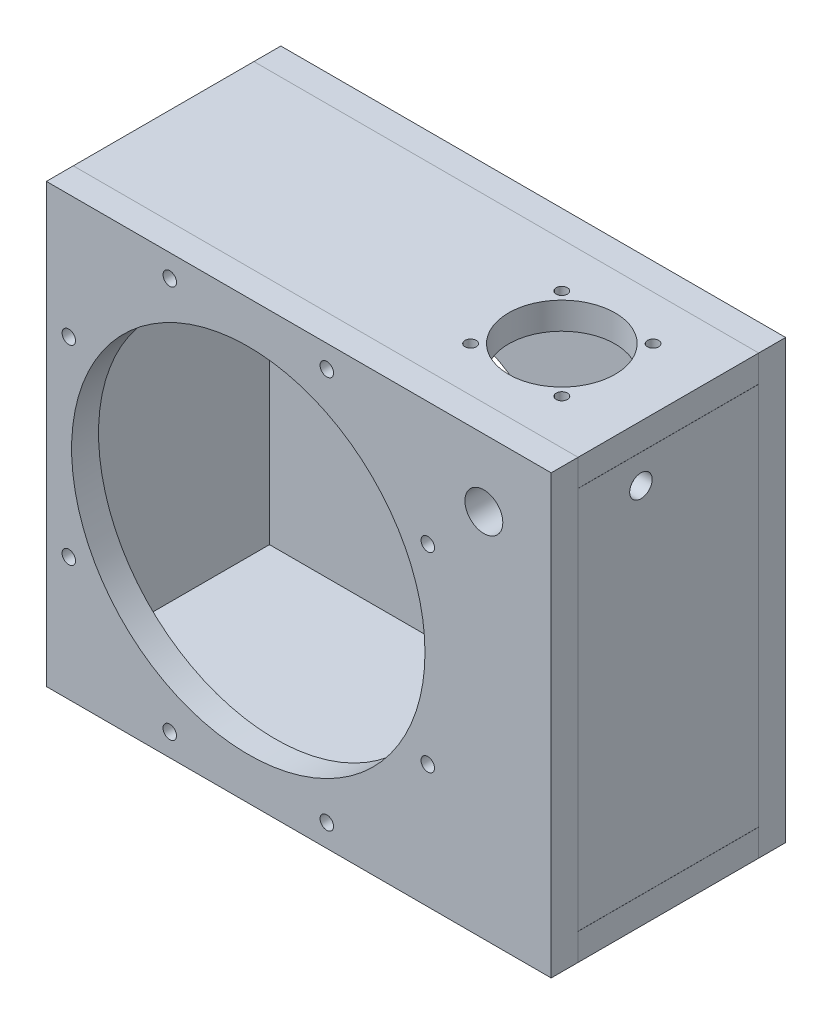
from build123d import *

# Parameters (mm, degrees)
SKETCH_1_W           = 450
SKETCH_1_H           = 390
EXTRUDE_1_DEPTH      = 24
SKETCH_2_W           = 450
SKETCH_2_H           = 390
SKETCH_2_W_2         = 402
SKETCH_2_H_2         = 342
EXTRUDE_2_DEPTH      = 161
SKETCH_3_W           = 450
SKETCH_3_H           = 390
EXTRUDE_3_DEPTH      = 24
SKETCH_6_R           = 82.5
CUT_EXTRUDE_3_DEPTH  = 33
SKETCH_9_R           = 4
CUT_EXTRUDE_4_DEPTH  = 18
SKETCH_4_R           = 157.5
CUT_EXTRUDE_5_DEPTH  = 43
SKETCH_5_R           = 47.5
CUT_EXTRUDE_6_DEPTH  = 43
SKETCH_10_R          = 5
CUT_EXTRUDE_7_DEPTH  = 18
SKETCH_11_W          = 161
SKETCH_11_H          = 0.1
CUT_EXTRUDE_8_DEPTH  = 632.09508
SKETCH_12_R          = 47.5
CUT_EXTRUDE_9_DEPTH  = 40.2
SKETCH_13_R          = 5
CUT_EXTRUDE_10_DEPTH = 18
SKETCH_14_W          = 10
SKETCH_14_H          = 341.9
CUT_EXTRUDE_12_DEPTH = 161
SKETCH_17_R          = 4
CUT_EXTRUDE_14_DEPTH = 20
SKETCH_19_R          = 8
CUT_EXTRUDE_18_DEPTH = 20
SKETCH_20_R          = 6
CUT_EXTRUDE_19_DEPTH = 20
SKETCH_21_R          = 10
CUT_EXTRUDE_20_DEPTH = 35
SKETCH_22_R          = 16.875
CUT_EXTRUDE_21_DEPTH = 40


with BuildPart() as part:
    # 草图1 → 拉伸1 (new body)
    with BuildSketch(Plane.XY):
        with Locations((225, -195)):
            Rectangle(SKETCH_1_W, SKETCH_1_H)
    extrude(amount=EXTRUDE_1_DEPTH)

    # 草图6 → 切除-拉伸3 (cut)
    with BuildSketch(Plane(origin=(0, 0, 0), x_dir=(-1, 0, 0), z_dir=(0, 0, -1))):
        with Locations((-180, -195)):
            Circle(SKETCH_6_R)
    extrude(amount=-CUT_EXTRUDE_3_DEPTH, mode=Mode.SUBTRACT)

    # 草图9 → 切除-拉伸4 (cut)
    with BuildSketch(Plane(origin=(0, 0, 0), x_dir=(-1, 0, 0), z_dir=(0, 0, -1))):
        with Locations((-180, -102.5)):
            Circle(SKETCH_9_R)
        with Locations((-125.629864163, -120.16592802)):
            Circle(SKETCH_9_R)
        with Locations((-92.027272243, -166.41592802)):
            Circle(SKETCH_9_R)
        with Locations((-92.027272243, -223.58407198)):
            Circle(SKETCH_9_R)
        with Locations((-125.629864163, -269.83407198)):
            Circle(SKETCH_9_R)
        with Locations((-180, -287.5)):
            Circle(SKETCH_9_R)
        with Locations((-234.370135837, -269.83407198)):
            Circle(SKETCH_9_R)
        with Locations((-267.972727757, -223.58407198)):
            Circle(SKETCH_9_R)
        with Locations((-267.972727757, -166.41592802)):
            Circle(SKETCH_9_R)
        with Locations((-234.370135837, -120.16592802)):
            Circle(SKETCH_9_R)
    extrude(amount=-CUT_EXTRUDE_4_DEPTH, mode=Mode.SUBTRACT)


with BuildPart() as body_2:
    # 草图2 → 拉伸2 (new body)
    with BuildSketch(Plane.XY.offset(24)):
        with Locations((225, -195)):
            Rectangle(SKETCH_2_W, SKETCH_2_H)
        with Locations((225, -195)):
            Rectangle(SKETCH_2_W_2, SKETCH_2_H_2, mode=Mode.SUBTRACT)
    extrude(amount=EXTRUDE_2_DEPTH)

    # 草图5 → 切除-拉伸6 (cut)
    with BuildSketch(Plane.XZ.offset(390)):
        with Locations(Location((355, 104.5, 0), (0, 0, 270))):
            Circle(SKETCH_5_R)
    extrude(amount=-CUT_EXTRUDE_6_DEPTH, mode=Mode.SUBTRACT)

    # 草图10 → 切除-拉伸7 (cut)
    with BuildSketch(Plane.XZ.offset(390)):
        with Locations(Location((395.658639918, 145.158639918, 0), (0, 0, 270))):
            Circle(SKETCH_10_R)
        with Locations(Location((395.658639918, 63.841360082, 0), (0, 0, 270))):
            Circle(SKETCH_10_R)
        with Locations(Location((314.341360082, 63.841360082, 0), (0, 0, 270))):
            Circle(SKETCH_10_R)
        with Locations(Location((314.341360082, 145.158639918, 0), (0, 0, 270))):
            Circle(SKETCH_10_R)
    extrude(amount=-CUT_EXTRUDE_7_DEPTH, mode=Mode.SUBTRACT)

    # 草图11 → 切除-拉伸8 (cut, through all)
    with BuildSketch(Plane.ZY):
        with Locations((104.5, -24.05)):
            Rectangle(SKETCH_11_W, SKETCH_11_H)
        with Locations((104.5, -365.95)):
            Rectangle(SKETCH_11_W, SKETCH_11_H)
    extrude(amount=-CUT_EXTRUDE_8_DEPTH, mode=Mode.SUBTRACT)


with BuildPart() as body_3:
    # 草图3 → 拉伸3 (new body)
    with BuildSketch(Plane.XY.offset(185)):
        with Locations((225, -195)):
            Rectangle(SKETCH_3_W, SKETCH_3_H)
    extrude(amount=EXTRUDE_3_DEPTH)

    # 草图4 → 切除-拉伸5 (cut)
    with BuildSketch(Plane.XY.offset(209)):
        with Locations((180, -195)):
            Circle(SKETCH_4_R)
    extrude(amount=-CUT_EXTRUDE_5_DEPTH, mode=Mode.SUBTRACT)


with BuildPart() as cut_extrude_8_piece_1:
    # of the separate pieces the step leaves, piece 1, a body of its own (cut_extrude_8_pieces)
    add(body_2.part.solids().sort_by_distance((0, 0, 24))[0])

    # 草图12 → 切除-拉伸9 (cut)
    with BuildSketch(Plane(origin=(0, 0, 0), x_dir=(1, 0, 0), z_dir=(0, 1, 0))):
        with Locations(Location((355, -104.5, 0), (0, 0, 90))):
            Circle(SKETCH_12_R)
    extrude(amount=-CUT_EXTRUDE_9_DEPTH, mode=Mode.SUBTRACT)

    # 草图13 → 切除-拉伸10 (cut)
    with BuildSketch(Plane(origin=(0, 0, 0), x_dir=(1, 0, 0), z_dir=(0, 1, 0))):
        with Locations(Location((395.658639918, -145.158639918, 0), (0, 0, 90))):
            Circle(SKETCH_13_R)
        with Locations(Location((314.341360082, -145.158639918, 0), (0, 0, 90))):
            Circle(SKETCH_13_R)
        with Locations(Location((395.658639918, -63.841360082, 0), (0, 0, 90))):
            Circle(SKETCH_13_R)
        with Locations(Location((314.341360082, -63.841360082, 0), (0, 0, 90))):
            Circle(SKETCH_13_R)
    extrude(amount=-CUT_EXTRUDE_10_DEPTH, mode=Mode.SUBTRACT)


with BuildPart() as cut_extrude_8_piece_2:
    # of the separate pieces the step leaves, piece 2, a body of its own (cut_extrude_8_pieces)
    add(body_2.part.solids().sort_by_distance((0, -390, 24))[0])


with BuildPart() as cut_extrude_8_piece_3:
    # of the separate pieces the step leaves, piece 3, a body of its own (cut_extrude_8_pieces)
    add(body_2.part.solids().sort_by_distance((450, -24.1, 24))[0])


with BuildPart() as cut_extrude_8_piece_4:
    # of the separate pieces the step leaves, piece 4, a body of its own (cut_extrude_8_pieces)
    add(body_2.part.solids().sort_by_distance((0, -365.9, 24))[0])


with BuildPart() as cut_extrude_12_tool:
    # 草图14 → 切除-拉伸12 (new body)
    with BuildSketch(Plane(origin=(0, 0, 24), x_dir=(-1, 0, 0), z_dir=(0, 0, -1))):
        with Locations((-19, -195.05)):
            Rectangle(SKETCH_14_W, SKETCH_14_H)
        with Locations((-431, -195.05)):
            Rectangle(SKETCH_14_W, SKETCH_14_H)
    extrude(amount=-CUT_EXTRUDE_12_DEPTH)


with BuildPart() as cut_extrude_8_piece_3_1:
    add(cut_extrude_8_piece_3.part)

    # 切除-拉伸12: cut by cut_extrude_12_tool
    add(cut_extrude_12_tool.part, mode=Mode.SUBTRACT)

    # 草图21 → 切除-拉伸20 (cut)
    with BuildSketch(Plane(origin=(450, 0, 0), x_dir=(0, 0, -1), z_dir=(1, 0, 0))):
        with Locations((-129, -50)):
            Circle(SKETCH_21_R)
    extrude(amount=-CUT_EXTRUDE_20_DEPTH, mode=Mode.SUBTRACT)


with BuildPart() as cut_extrude_8_piece_4_1:
    add(cut_extrude_8_piece_4.part)

    # 切除-拉伸12: cut by cut_extrude_12_tool
    add(cut_extrude_12_tool.part, mode=Mode.SUBTRACT)


with BuildPart() as cut_extrude_14_tool:
    # 草图17 → 切除-拉伸14 (new body)
    with BuildSketch(Plane.XZ.offset(390)):
        with Locations(Location((70, 194.5, 0), (0, 0, 270))):
            Circle(SKETCH_17_R)
        with Locations(Location((200, 194.5, 0), (0, 0, 270))):
            Circle(SKETCH_17_R)
        with Locations(Location((70, 14.5, 0), (0, 0, 270))):
            Circle(SKETCH_17_R)
        with Locations(Location((200, 14.5, 0), (0, 0, 270))):
            Circle(SKETCH_17_R)
    extrude(amount=-CUT_EXTRUDE_14_DEPTH)


with BuildPart() as part_1:
    add(part.part)

    # 切除-拉伸14: cut by cut_extrude_14_tool
    add(cut_extrude_14_tool.part, mode=Mode.SUBTRACT)

    # 草图19 → 切除-拉伸18 (cut)
    with BuildSketch(Plane(origin=(0, 0, 0), x_dir=(-1, 0, 0), z_dir=(0, 0, -1))):
        with Locations((-400, -15)):
            Circle(SKETCH_19_R)
        with Locations((-225, -15)):
            Circle(SKETCH_19_R)
        with Locations((-50, -15)):
            Circle(SKETCH_19_R)
        with Locations((-400, -375)):
            Circle(SKETCH_19_R)
        with Locations((-225, -375)):
            Circle(SKETCH_19_R)
        with Locations((-50, -375)):
            Circle(SKETCH_19_R)
    extrude(amount=-CUT_EXTRUDE_18_DEPTH, mode=Mode.SUBTRACT)


with BuildPart() as body_3_1:
    add(body_3.part)

    # 切除-拉伸14: cut by cut_extrude_14_tool
    add(cut_extrude_14_tool.part, mode=Mode.SUBTRACT)

    # 草图20 → 切除-拉伸19 (cut)
    with BuildSketch(Plane.XY.offset(209)):
        with Locations((110, -20)):
            Circle(SKETCH_20_R)
        with Locations((250, -20)):
            Circle(SKETCH_20_R)
        with Locations((110, -370)):
            Circle(SKETCH_20_R)
        with Locations((250, -370)):
            Circle(SKETCH_20_R)
        with Locations((20, -110)):
            Circle(SKETCH_20_R)
        with Locations((340, -110)):
            Circle(SKETCH_20_R)
        with Locations((20, -280)):
            Circle(SKETCH_20_R)
        with Locations((340, -280)):
            Circle(SKETCH_20_R)
    extrude(amount=-CUT_EXTRUDE_19_DEPTH, mode=Mode.SUBTRACT)

    # 草图22 → 切除-拉伸21 (cut)
    with BuildSketch(Plane.XY.offset(209)):
        with Locations((390, -60)):
            Circle(SKETCH_22_R)
    extrude(amount=-CUT_EXTRUDE_21_DEPTH, mode=Mode.SUBTRACT)


solid = Compound([cut_extrude_8_piece_1.part, cut_extrude_8_piece_2.part, cut_extrude_8_piece_3_1.part, cut_extrude_8_piece_4_1.part, part_1.part, body_3_1.part])
